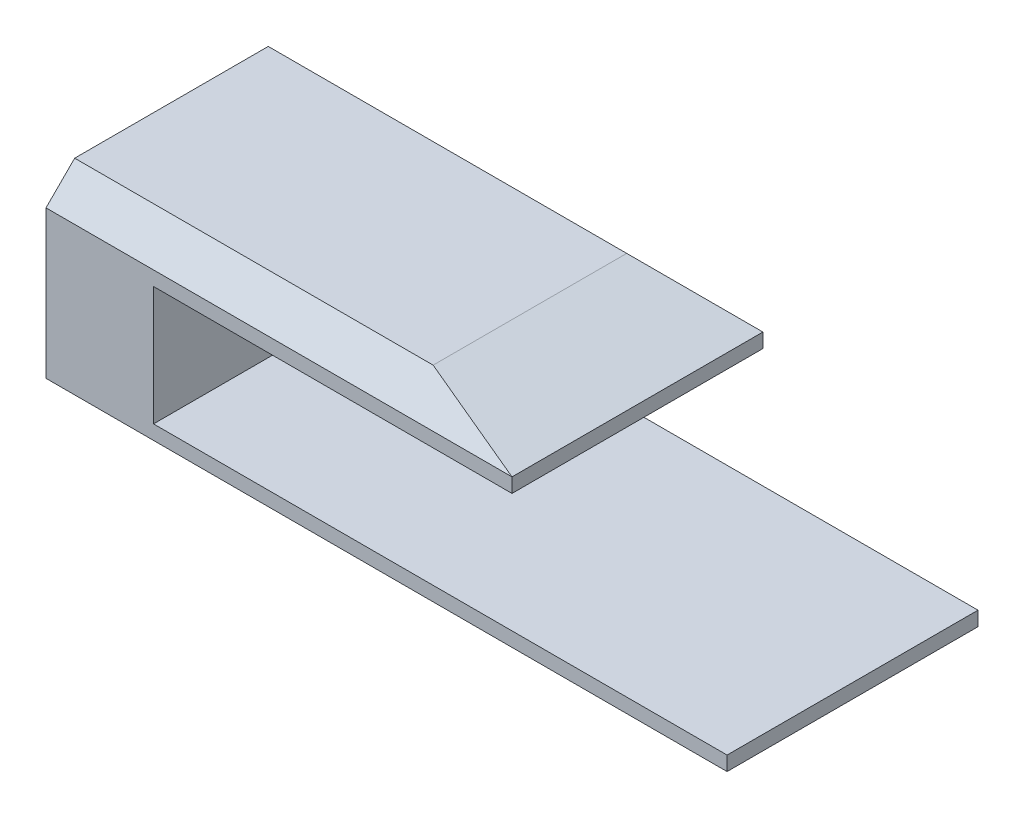
from build123d import *

# Parameters (mm, degrees)
EXTRUDE_1_DEPTH     = 35
CUT_EXTRUDE_2_DEPTH = 3
SKETCH_4_R          = 2.5
CUT_EXTRUDE_3_DEPTH = 15
CHAMFER_2_SIZE      = 4
CHAMFER_3_SIZE      = 4
CHAMFER_4_SIZE      = 4
CHAMFER_4_SIZE2     = 15
CHAMFER_5_SIZE      = 15
CHAMFER_5_SIZE2     = 4


with BuildPart() as part:
    # Эскиз2 → Бобышка-Вытянуть1 (new body)
    with BuildSketch(Plane.XY):
        Polygon((0, 0), (65, 0), (65, -6), (15, -6), (15, -22.6), (95, -22.6), (95, -28.6), (0, -28.6), align=None)
    extrude(amount=EXTRUDE_1_DEPTH)

    # Эскиз3 → Вырез-Вытянуть2 (cut)
    with BuildSketch(Plane.ZY):
        Polygon((6.893398282, -14.3), (17.5, -24.906601718), (28.106601718, -14.3), (17.5, -3.693398282), align=None)
    extrude(amount=-CUT_EXTRUDE_2_DEPTH, mode=Mode.SUBTRACT)

    # Эскиз4 → Вырез-Вытянуть3 (cut)
    with BuildSketch(Plane.ZY):
        with Locations(Location((17.5, -14.3, 0), (0, 0, 270))):
            Circle(SKETCH_4_R)
    extrude(amount=-CUT_EXTRUDE_3_DEPTH, mode=Mode.SUBTRACT)

    # Фаска2
    chamfer_2_edges = [part.edges().sort_by_distance(p)[0] for p in [
        (15, -11.8, 17.5),
    ]]
    chamfer(chamfer_2_edges, length=CHAMFER_2_SIZE)

    # Фаска3
    chamfer_3_edges = [part.edges().sort_by_distance(p)[0] for p in [
        (47.5, -28.6, 0),
        (32.5, 0, 35),
        (32.5, 0, 0),
        (47.5, -28.6, 35),
    ]]
    chamfer(chamfer_3_edges, length=CHAMFER_3_SIZE)

    # Фаска4
    chamfer_4_edges = [part.edges().sort_by_distance(p)[0] for p in [
        (65, 0, 17.5),
    ]]
    chamfer_4_side = [part.faces().sort_by_distance(p)[0] for p in [
        (65, -3.137457045, 17.5),
    ]]
    chamfer(chamfer_4_edges, length=CHAMFER_4_SIZE, length2=CHAMFER_4_SIZE2, reference=chamfer_4_side[0])

    # Фаска5
    chamfer_5_edges = [part.edges().sort_by_distance(p)[0] for p in [
        (95, -28.6, 17.5),
    ]]
    chamfer_5_side = [part.faces().sort_by_distance(p)[0] for p in [
        (47.5, -28.6, 17.5),
    ]]
    chamfer(chamfer_5_edges, length=CHAMFER_5_SIZE, length2=CHAMFER_5_SIZE2, reference=chamfer_5_side[0])


solid = part.part
